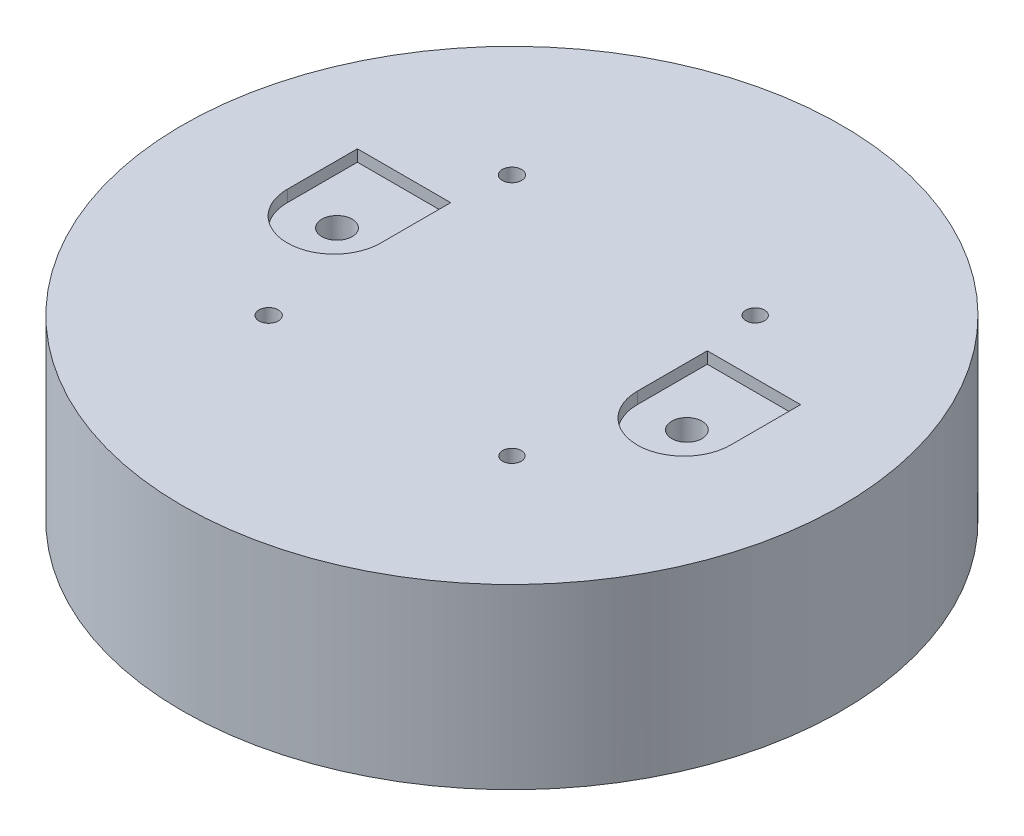
from build123d import *

# Parameters (mm, degrees)
SKETCH2_R                = 56.515
SKETCH2_R_2              = 51.435
BOSS_EXTRUDE1_DEPTH      = 15.24
SKETCH2_R_3              = 47.201666667
SKETCH2_R_4              = 42.121666667
BOSS_EXTRUDE1_2_DEPTH    = 15.24
SKETCH3_R                = 56.515
BOSS_EXTRUDE2_DEPTH      = 15.24
CUT_EXTRUDE1_DEPTH       = 86.539001923
CUT_EXTRUDE1_DEPTH_BACK  = 86.539001923
SKETCH4_R                = 1.6
SKETCH4_R_2              = 1.65876763
SKETCH4_R_3              = 1.651
SKETCH14_R               = 10
CUT_EXTRUDE7_DEPTH       = 19.558
SKETCH16_W               = 1.27
SKETCH16_H               = 1.27
EXTRUDE_THIN1_DEPTH      = 15.24
SKETCH20_R               = 66.675
SKETCH20_R_2             = 56.515
CUT_EXTRUDE_THIN3_DEPTH  = 15.748
CUT_EXTRUDE12_DEPTH      = 15.748
SKETCH32_R               = 2.6
CUT_EXTRUDE18_DEPTH      = 2
CUT_EXTRUDE19_DEPTH      = 86.539002091
CUT_EXTRUDE19_DEPTH_BACK = 86.539002091
SKETCH33_R               = 2.6
SKETCH34_R               = 6
CUT_EXTRUDE20_DEPTH      = 5


with BuildPart() as part:
    # Sketch2 → Boss-Extrude1 (new body)
    with BuildSketch(Plane(origin=(0, 0, 0), x_dir=(1, 0, 0), z_dir=(0, 1, 0))):
        with Locations(Location((0, 0, 0), (0, 0, 90))):
            Circle(SKETCH2_R)
        with Locations(Location((0, 0, 0), (0, 0, 90))):
            Circle(SKETCH2_R_2, mode=Mode.SUBTRACT)
    extrude(amount=BOSS_EXTRUDE1_DEPTH)



with BuildPart() as body_2:
    # Sketch2 → Boss-Extrude1 2 (new body)
    with BuildSketch(Plane(origin=(0, 0, 0), x_dir=(1, 0, 0), z_dir=(0, 1, 0))):
        with Locations(Location((0, 0, 0), (0, 0, 90))):
            Circle(SKETCH2_R_3)
        with Locations(Location((0, 0, 0), (0, 0, 90))):
            Circle(SKETCH2_R_4, mode=Mode.SUBTRACT)
    extrude(amount=BOSS_EXTRUDE1_2_DEPTH)


with BuildPart() as part_1:
    add(part.part)

    add(body_2.part)  # Boss-Extrude2 merges body 2
    # Sketch3 → Boss-Extrude2 (add)
    with BuildSketch(Plane(origin=(0, 15.24, 0), x_dir=(1, 0, 0), z_dir=(0, 1, 0))):
        with Locations(Location((0, 0, 0), (0, 0, 90))):
            Circle(SKETCH3_R)
    extrude(amount=BOSS_EXTRUDE2_DEPTH)

    # Sketch4 → Cut-Extrude1 (cut, two sides: drawn at the far end of the back side and taken through both)
    with BuildSketch(Plane(origin=(0, 30.48, 0), x_dir=(1, 0, 0), z_dir=(0, 1, 0)).offset(-CUT_EXTRUDE1_DEPTH_BACK)):
        with Locations(Location((20.859650045, 20.859650045, 0), (0, 0, 270))):
            Circle(SKETCH4_R)
        with Locations(Location((20.859650045, -20.859650045, 0), (0, 0, 270))):
            Circle(SKETCH4_R)
        with Locations(Location((-20.859650045, -20.859650045, 0), (0, 0, 270))):
            Circle(SKETCH4_R_2)
        with Locations(Location((-20.859650045, 20.859650045, 0), (0, 0, 270))):
            Circle(SKETCH4_R_3)
    extrude(amount=CUT_EXTRUDE1_DEPTH + CUT_EXTRUDE1_DEPTH_BACK, mode=Mode.SUBTRACT)

    # Sketch14 → Cut-Extrude7 (cut)
    with BuildSketch(Plane.XY.offset(-56.515)):
        with Locations((0, 5.08)):
            Circle(SKETCH14_R)
    extrude(amount=CUT_EXTRUDE7_DEPTH, mode=Mode.SUBTRACT)

    # Sketch16 → Extrude-Thin1 (add)
    # profile 1 of 2: a face of its own
    with BuildSketch(Plane.XY.offset(-56.515)):
        with Locations((-0.635, 0.635)):
            Rectangle(SKETCH16_W, SKETCH16_H)
    # profile 2 of 2: a face of its own
    with BuildSketch(Plane.XY.offset(-56.515)):
        with BuildLine():
            Line((10.060144134, 0), (-10.060144134, 0))
            ThreePointArc((-10.060144134, 0), (0, 16.35), (10.060144134, 0))
        make_face()
        with BuildLine():
            Line((9.245750375, 1.27), (-9.245750375, 1.27))
            ThreePointArc((-9.245750375, 1.27), (0, 15.08), (9.245750375, 1.27))
        make_face(mode=Mode.SUBTRACT)
    extrude(amount=EXTRUDE_THIN1_DEPTH)

    # Sketch20 → Cut-Extrude-Thin3 (cut)
    with BuildSketch(Plane(origin=(0, 0, 0), x_dir=(-1, 0, 0), z_dir=(0, -1, 0))):
        Circle(SKETCH20_R)
        Circle(SKETCH20_R_2, mode=Mode.SUBTRACT)
    extrude(amount=-CUT_EXTRUDE_THIN3_DEPTH, mode=Mode.SUBTRACT)

    # Sketch21 → Cut-Extrude12 (cut)
    with BuildSketch(Plane.XY.offset(-56.515)):
        Polygon((-9.303733138, 0), (-9.245750375, 1.27), (9.245750375, 1.27), (9.245750375, 0), align=None)
    extrude(amount=CUT_EXTRUDE12_DEPTH, mode=Mode.SUBTRACT)

    # Sketch32 → Cut-Extrude18 (cut)
    # profile 1 of 2: a face of its own
    with BuildSketch(Plane(origin=(0, 30.48, 0), x_dir=(1, 0, 0), z_dir=(0, 1, 0))):
        with BuildLine():
            Line((-22, 11.5), (-38, 11.5))
            Line((-38, 11.5), (-38, -0.5))
            ThreePointArc((-38, -0.5), (-30, -8.5), (-22, -0.5))
            Line((-22, -0.5), (-22, 11.5))
        make_face()
        with Locations(Location((-30, 0, 0), (0, 0, 270))):
            Circle(SKETCH32_R, mode=Mode.SUBTRACT)
    # profile 2 of 2: a face of its own
    with BuildSketch(Plane(origin=(0, 30.48, 0), x_dir=(1, 0, 0), z_dir=(0, 1, 0))):
        with BuildLine():
            Line((38, -0.5), (38, 11.5))
            Line((38, 11.5), (22, 11.5))
            Line((22, 11.5), (22, -0.5))
            ThreePointArc((22, -0.5), (30, -8.5), (38, -0.5))
        make_face()
        with Locations(Location((30, 0, 0), (0, 0, 90))):
            Circle(SKETCH32_R, mode=Mode.SUBTRACT)
    extrude(amount=-CUT_EXTRUDE18_DEPTH, mode=Mode.SUBTRACT)

    # Sketch33 → Cut-Extrude19 (cut, two sides: drawn at the far end of the back side and taken through both)
    with BuildSketch(Plane(origin=(0, 30.48, 0), x_dir=(1, 0, 0), z_dir=(0, 1, 0)).offset(-CUT_EXTRUDE19_DEPTH_BACK)):
        with Locations(Location((-30, 0, 0), (0, 0, 270))):
            Circle(SKETCH33_R)
        with Locations(Location((30, 0, 0), (0, 0, 270))):
            Circle(SKETCH33_R)
    extrude(amount=CUT_EXTRUDE19_DEPTH + CUT_EXTRUDE19_DEPTH_BACK, mode=Mode.SUBTRACT)

    # Sketch34 → Cut-Extrude20 (cut)
    with BuildSketch(Plane(origin=(0, 15.24, 0), x_dir=(-1, 0, 0), z_dir=(0, -1, 0))):
        with Locations(Location((30, 0, 0), (0, 0, 90))):
            Circle(SKETCH34_R)
        with Locations(Location((-30, 0, 0), (0, 0, 90))):
            Circle(SKETCH34_R)
    extrude(amount=-CUT_EXTRUDE20_DEPTH, mode=Mode.SUBTRACT)


solid = part_1.part
